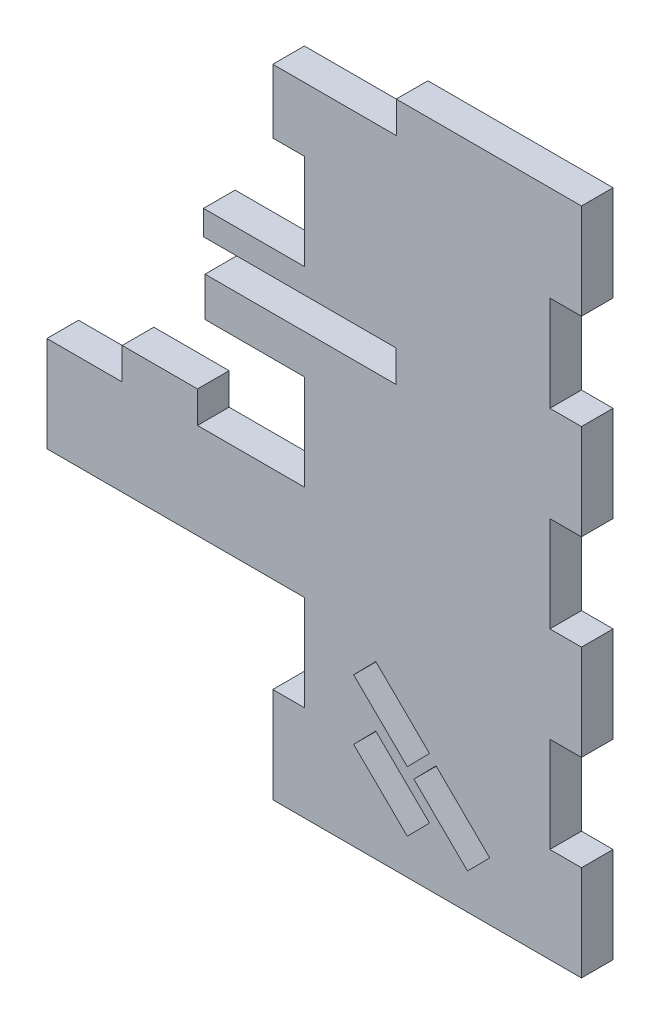
from build123d import *

# Parameters (mm, degrees)
SKETCH1_W           = 52.07
SKETCH1_H           = 112.776
BOSS_EXTRUDE1_DEPTH = 5.334
SKETCH2_W           = 5.334
SKETCH2_H           = 16.110857143
SKETCH2_H_2         = 16.110857142
CUT_EXTRUDE1_DEPTH  = 82.040197417
CUT_EXTRUDE2_DEPTH  = 82.040197417
SKETCH5_W           = 5.334
SKETCH5_H           = 16.110857143
BOSS_EXTRUDE2_DEPTH = 38.1
SKETCH6_W           = 12.7
SKETCH6_H           = 5.334
BOSS_EXTRUDE3_DEPTH = 5.334
SKETCH7_W           = 20.804949133
SKETCH7_H           = 5.334
CUT_EXTRUDE4_DEPTH  = 106.172156174
SKETCH8_W           = 5.334
SKETCH8_H           = 6.622142857
BOSS_EXTRUDE4_DEPTH = 11.43
SKETCH9_W           = 20.828
SKETCH9_H           = 5.334
CUT_EXTRUDE5_DEPTH  = 106.172156174
SKETCH10_W          = 5.334
SKETCH10_H          = 4.154714286
BOSS_EXTRUDE5_DEPTH = 11.684


with BuildPart() as part:
    # Sketch1 → Boss-Extrude1 (new body)
    with BuildSketch(Plane.XY):
        with Locations((-13.887031982, -13.934780119)):
            Rectangle(SKETCH1_W, SKETCH1_H)
    extrude(amount=BOSS_EXTRUDE1_DEPTH)

    # Sketch2 → Cut-Extrude1 (cut, through all)
    with BuildSketch(Plane.XY.offset(5.334)):
        with Locations((-37.255031982, 18.286934167)):
            Rectangle(SKETCH2_W, SKETCH2_H)
        with Locations((-37.255031982, -13.93478012)):
            Rectangle(SKETCH2_W, SKETCH2_H)
        with Locations((-37.255031982, -46.156494405)):
            Rectangle(SKETCH2_W, SKETCH2_H_2)
        with Locations((9.480968018, -46.156494405)):
            Rectangle(SKETCH2_W, SKETCH2_H_2)
        with Locations((9.480968018, -13.93478012)):
            Rectangle(SKETCH2_W, SKETCH2_H)
        with Locations((9.480968018, 18.286934167)):
            Rectangle(SKETCH2_W, SKETCH2_H)
    extrude(amount=-CUT_EXTRUDE1_DEPTH, mode=Mode.SUBTRACT)

    # Sketch3 → Cut-Extrude2 (cut, through all)
    with BuildSketch(Plane.XY.offset(5.334)):
        Polygon((-22.544809753, -41.442678073), (-13.491049115, -50.348823048), (-17.231630005, -54.151402516), (-26.285390642, -45.245257541), align=None)
        Polygon((-22.544809753, -51.602678073), (-13.491049115, -60.508823048), (-17.231630005, -64.311402516), (-26.285390642, -55.405257541), align=None)
        Polygon((-12.384809753, -51.602678073), (-3.331049115, -60.508823048), (-7.071630005, -64.311402516), (-16.125390642, -55.405257541), align=None)
    extrude(amount=-CUT_EXTRUDE2_DEPTH, mode=Mode.SUBTRACT)

    # Sketch5 → Boss-Extrude2 (add)
    with BuildSketch(Plane.ZY.offset(39.922031982)):
        with Locations((2.667, -30.045637263)):
            Rectangle(SKETCH5_W, SKETCH5_H)
    extrude(amount=BOSS_EXTRUDE2_DEPTH)

    # Sketch6 → Boss-Extrude3 (add)
    with BuildSketch(Plane(origin=(0, -21.990208691, 0), x_dir=(1, 0, 0), z_dir=(0, 1, 0))):
        with Locations((-58.972031982, -2.667)):
            Rectangle(SKETCH6_W, SKETCH6_H)
    extrude(amount=BOSS_EXTRUDE3_DEPTH)

    # Sketch7 → Cut-Extrude4 (cut, through all)
    with BuildSketch(Plane.XY.offset(5.334)):
        with Locations((-29.519557416, 3.409791309)):
            Rectangle(SKETCH7_W, SKETCH7_H)
    extrude(amount=-CUT_EXTRUDE4_DEPTH, mode=Mode.SUBTRACT)

    # Sketch8 → Boss-Extrude4 (add)
    with BuildSketch(Plane.ZY.offset(39.922031982)):
        with Locations((2.667, -2.56828012)):
            Rectangle(SKETCH8_W, SKETCH8_H)
    extrude(amount=BOSS_EXTRUDE4_DEPTH)

    # Sketch9 → Cut-Extrude5 (cut, through all)
    with BuildSketch(Plane.XY.offset(5.334)):
        with Locations((-29.508031982, 39.786219881)):
            Rectangle(SKETCH9_W, SKETCH9_H)
    extrude(amount=-CUT_EXTRUDE5_DEPTH, mode=Mode.SUBTRACT)

    # Sketch10 → Boss-Extrude5 (add)
    with BuildSketch(Plane.ZY.offset(39.922031982)):
        with Locations((2.667, 8.154148452)):
            Rectangle(SKETCH10_W, SKETCH10_H)
    extrude(amount=BOSS_EXTRUDE5_DEPTH)


solid = part.part
